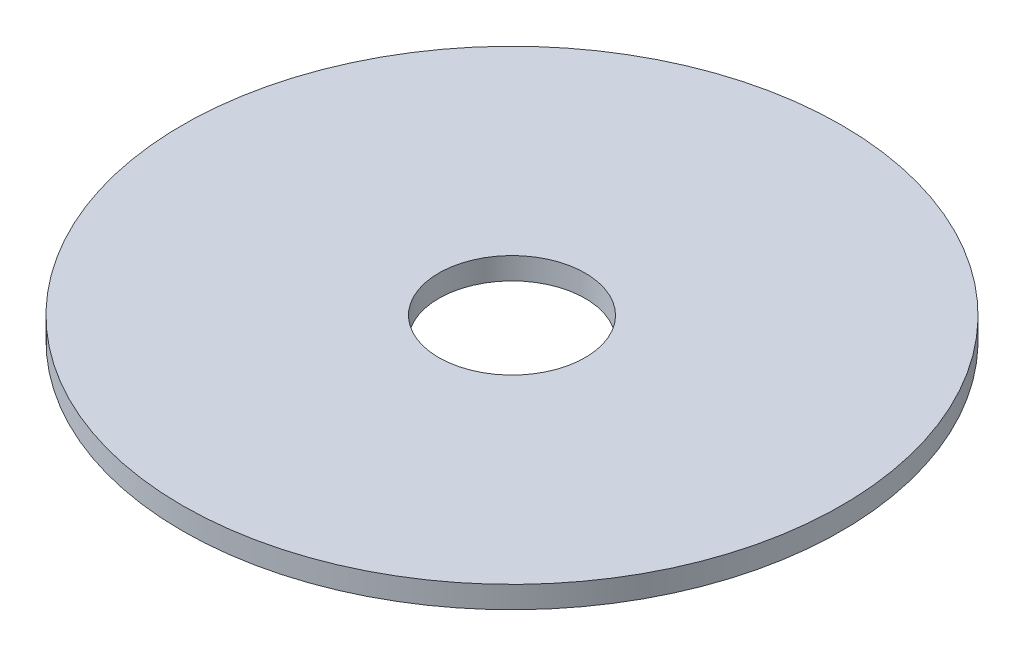
from build123d import *

# Parameters (mm, degrees)
SKETCH1_R           = 45
SKETCH1_R_2         = 10
BOSS_EXTRUDE1_DEPTH = 1.5


with BuildPart() as part:
    # Sketch1 → Boss-Extrude1 (new, symmetric)
    with BuildSketch(Plane(origin=(0, 0, 0), x_dir=(1, 0, 0), z_dir=(0, 1, 0))):
        with Locations(Location((0, 0, 0), (0, 0, 270))):
            Circle(SKETCH1_R)
        with Locations(Location((0, 0, 0), (0, 0, 270))):
            Circle(SKETCH1_R_2, mode=Mode.SUBTRACT)
    extrude(amount=BOSS_EXTRUDE1_DEPTH, both=True)


solid = part.part
